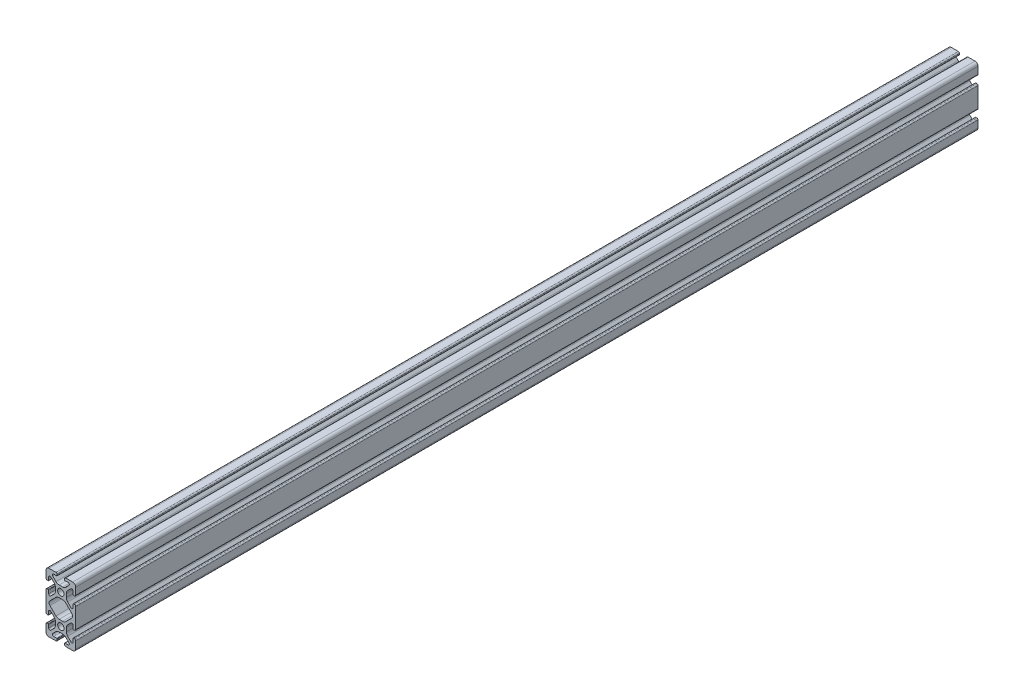
from build123d import *

# Parameters (mm, degrees)
SKETCH3_R           = 2.15
BOSS_EXTRUDE1_DEPTH = 304.8
CIRPATTERN1_COUNT   = 2
SKETCH4_R           = 2.15
CUT_EXTRUDE1_DEPTH  = 2.09


with BuildPart() as part:
    # Sketch3 → Boss-Extrude1 (new, symmetric)
    with BuildSketch(Plane.XY):
        with BuildLine():
            Line((-8.5, 7.5), (-9.2, 7.5))
            ThreePointArc((-9.2, 7.5), (-9.765685425, 7.265685425), (-10, 6.7))
            Line((-10, 6.7), (-10, 0))
            Line((-10, 0), (-7.916458339, 0))
            ThreePointArc((-7.916458339, 0), (-7.764217404, 0.765366865), (-7.330671901, 1.414213562))
            Line((-7.330671901, 1.414213562), (-3.32356512, 5.421320344))
            ThreePointArc((-3.32356512, 5.421320344), (-2.350295073, 6.071638598), (-1.202244776, 6.3))
            Line((-1.202244776, 6.3), (1.202244776, 6.3))
            ThreePointArc((1.202244776, 6.3), (2.350295073, 6.071638598), (3.32356512, 5.421320344))
            Line((3.32356512, 5.421320344), (7.330671901, 1.414213562))
            ThreePointArc((7.330671901, 1.414213562), (7.764217404, 0.765366865), (7.916458339, 0))
            Line((7.916458339, 0), (10, 0))
            Line((10, 0), (10, 6.7))
            ThreePointArc((10, 6.7), (9.765685425, 7.265685425), (9.2, 7.5))
            Line((9.2, 7.5), (8.5, 7.5))
            ThreePointArc((8.5, 7.5), (8.287867966, 7.412132034), (8.2, 7.2))
            Line((8.2, 7.2), (8.2, 5.094911614))
            ThreePointArc((8.2, 5.094911614), (7.678422063, 4.314315067), (6.757645654, 4.497468882))
            Line((6.757645654, 4.497468882), (4.578679656, 6.67643488))
            ThreePointArc((4.578679656, 6.67643488), (3.928361402, 7.649704927), (3.7, 8.797755224))
            Line((3.7, 8.797755224), (3.7, 11.202244776))
            ThreePointArc((3.7, 11.202244776), (3.928361402, 12.350295073), (4.578679656, 13.32356512))
            Line((4.578679656, 13.32356512), (6.757645654, 15.502531118))
            ThreePointArc((6.757645654, 15.502531118), (7.678422063, 15.685684933), (8.2, 14.905088386))
            Line((8.2, 14.905088386), (8.2, 12.8))
            ThreePointArc((8.2, 12.8), (8.287867966, 12.587867966), (8.5, 12.5))
            Line((8.5, 12.5), (9.2, 12.5))
            ThreePointArc((9.2, 12.5), (9.765685425, 12.734314575), (10, 13.3))
            Line((10, 13.3), (10, 18))
            ThreePointArc((10, 18), (9.414213562, 19.414213562), (8, 20))
            Line((8, 20), (3.3, 20))
            ThreePointArc((3.3, 20), (2.734314575, 19.765685425), (2.5, 19.2))
            Line((2.5, 19.2), (2.5, 18.5))
            ThreePointArc((2.5, 18.5), (2.587867966, 18.287867966), (2.8, 18.2))
            Line((2.8, 18.2), (4.905088386, 18.2))
            ThreePointArc((4.905088386, 18.2), (5.685684933, 17.678422063), (5.502531118, 16.757645654))
            Line((5.502531118, 16.757645654), (3.32356512, 14.578679656))
            ThreePointArc((3.32356512, 14.578679656), (2.350295073, 13.928361402), (1.202244776, 13.7))
            Line((1.202244776, 13.7), (-1.202244776, 13.7))
            ThreePointArc((-1.202244776, 13.7), (-2.350295073, 13.928361402), (-3.32356512, 14.578679656))
            Line((-3.32356512, 14.578679656), (-5.502531118, 16.757645654))
            ThreePointArc((-5.502531118, 16.757645654), (-5.685684933, 17.678422063), (-4.905088386, 18.2))
            Line((-4.905088386, 18.2), (-2.8, 18.2))
            ThreePointArc((-2.8, 18.2), (-2.587867966, 18.287867966), (-2.5, 18.5))
            Line((-2.5, 18.5), (-2.5, 19.2))
            ThreePointArc((-2.5, 19.2), (-2.734314575, 19.765685425), (-3.3, 20))
            Line((-3.3, 20), (-8, 20))
            ThreePointArc((-8, 20), (-9.414213562, 19.414213562), (-10, 18))
            Line((-10, 18), (-10, 13.3))
            ThreePointArc((-10, 13.3), (-9.765685425, 12.734314575), (-9.2, 12.5))
            Line((-9.2, 12.5), (-8.5, 12.5))
            ThreePointArc((-8.5, 12.5), (-8.287867966, 12.587867966), (-8.2, 12.8))
            Line((-8.2, 12.8), (-8.2, 14.905088386))
            ThreePointArc((-8.2, 14.905088386), (-7.678422063, 15.685684933), (-6.757645654, 15.502531118))
            Line((-6.757645654, 15.502531118), (-4.578679656, 13.32356512))
            ThreePointArc((-4.578679656, 13.32356512), (-3.928361402, 12.350295073), (-3.7, 11.202244776))
            Line((-3.7, 11.202244776), (-3.7, 8.797755224))
            ThreePointArc((-3.7, 8.797755224), (-3.928361402, 7.649704927), (-4.578679656, 6.67643488))
            Line((-4.578679656, 6.67643488), (-6.757645654, 4.497468882))
            ThreePointArc((-6.757645654, 4.497468882), (-7.678422063, 4.314315067), (-8.2, 5.094911614))
            Line((-8.2, 5.094911614), (-8.2, 7.2))
            ThreePointArc((-8.2, 7.2), (-8.287867966, 7.412132034), (-8.5, 7.5))
        make_face()
        with Locations(Location((0, 10, 0), (0, 0, 180))):
            Circle(SKETCH3_R, mode=Mode.SUBTRACT)
    boss_extrude1 = extrude(amount=BOSS_EXTRUDE1_DEPTH, both=True)

    # CirPattern1: Boss-Extrude1 ×2 about axis
    cirpattern1_axis = Axis((0, 0, 0), (0, 0, 1))
    for i in range(1, CIRPATTERN1_COUNT):
        add(boss_extrude1.rotate(cirpattern1_axis, i * 360 / CIRPATTERN1_COUNT))

    # Sketch4 → Cut-Extrude1 (cut)
    with BuildSketch(Plane.XY.offset(304.8)):
        with BuildLine():
            Line((-2.5, 18.5), (-2.5, 19.2))
            ThreePointArc((-2.5, 19.2), (-2.734314575, 19.765685425), (-3.3, 20))
            Line((-3.3, 20), (-8, 20))
            ThreePointArc((-8, 20), (-9.414213562, 19.414213562), (-10, 18))
            Line((-10, 18), (-10, 13.3))
            ThreePointArc((-10, 13.3), (-9.765685425, 12.734314575), (-9.2, 12.5))
            Line((-9.2, 12.5), (-8.5, 12.5))
            ThreePointArc((-8.5, 12.5), (-8.287867966, 12.587867966), (-8.2, 12.8))
            Line((-8.2, 12.8), (-8.2, 14.905088386))
            ThreePointArc((-8.2, 14.905088386), (-7.678422063, 15.685684933), (-6.757645654, 15.502531118))
            Line((-6.757645654, 15.502531118), (-4.578679656, 13.32356512))
            ThreePointArc((-4.578679656, 13.32356512), (-3.928361402, 12.350295073), (-3.7, 11.202244776))
            Line((-3.7, 11.202244776), (-3.7, 8.797755224))
            ThreePointArc((-3.7, 8.797755224), (-3.928361402, 7.649704927), (-4.578679656, 6.67643488))
            Line((-4.578679656, 6.67643488), (-6.757645654, 4.497468882))
            ThreePointArc((-6.757645654, 4.497468882), (-7.678422063, 4.314315067), (-8.2, 5.094911614))
            Line((-8.2, 5.094911614), (-8.2, 7.2))
            ThreePointArc((-8.2, 7.2), (-8.287867966, 7.412132034), (-8.5, 7.5))
            Line((-8.5, 7.5), (-9.2, 7.5))
            ThreePointArc((-9.2, 7.5), (-9.765685425, 7.265685425), (-10, 6.7))
            Line((-10, 6.7), (-10, -6.7))
            ThreePointArc((-10, -6.7), (-9.765685425, -7.265685425), (-9.2, -7.5))
            Line((-9.2, -7.5), (-8.5, -7.5))
            ThreePointArc((-8.5, -7.5), (-8.287867966, -7.412132034), (-8.2, -7.2))
            Line((-8.2, -7.2), (-8.2, -5.094911614))
            ThreePointArc((-8.2, -5.094911614), (-7.678422063, -4.314315067), (-6.757645654, -4.497468882))
            Line((-6.757645654, -4.497468882), (-4.578679656, -6.67643488))
            ThreePointArc((-4.578679656, -6.67643488), (-3.928361402, -7.649704927), (-3.7, -8.797755224))
            Line((-3.7, -8.797755224), (-3.7, -11.202244776))
            ThreePointArc((-3.7, -11.202244776), (-3.928361402, -12.350295073), (-4.578679656, -13.32356512))
            Line((-4.578679656, -13.32356512), (-6.757645654, -15.502531118))
            ThreePointArc((-6.757645654, -15.502531118), (-7.678422063, -15.685684933), (-8.2, -14.905088386))
            Line((-8.2, -14.905088386), (-8.2, -12.8))
            ThreePointArc((-8.2, -12.8), (-8.287867966, -12.587867966), (-8.5, -12.5))
            Line((-8.5, -12.5), (-9.2, -12.5))
            ThreePointArc((-9.2, -12.5), (-9.765685425, -12.734314575), (-10, -13.3))
            Line((-10, -13.3), (-10, -18))
            ThreePointArc((-10, -18), (-9.414213562, -19.414213562), (-8, -20))
            Line((-8, -20), (-3.3, -20))
            ThreePointArc((-3.3, -20), (-2.734314575, -19.765685425), (-2.5, -19.2))
            Line((-2.5, -19.2), (-2.5, -18.5))
            ThreePointArc((-2.5, -18.5), (-2.587867966, -18.287867966), (-2.8, -18.2))
            Line((-2.8, -18.2), (-4.905088386, -18.2))
            ThreePointArc((-4.905088386, -18.2), (-5.685684933, -17.678422063), (-5.502531118, -16.757645654))
            Line((-5.502531118, -16.757645654), (-3.32356512, -14.578679656))
            ThreePointArc((-3.32356512, -14.578679656), (-2.350295073, -13.928361402), (-1.202244776, -13.7))
            Line((-1.202244776, -13.7), (1.202244776, -13.7))
            ThreePointArc((1.202244776, -13.7), (2.350295073, -13.928361402), (3.32356512, -14.578679656))
            Line((3.32356512, -14.578679656), (5.502531118, -16.757645654))
            ThreePointArc((5.502531118, -16.757645654), (5.685684933, -17.678422063), (4.905088386, -18.2))
            Line((4.905088386, -18.2), (2.8, -18.2))
            ThreePointArc((2.8, -18.2), (2.587867966, -18.287867966), (2.5, -18.5))
            Line((2.5, -18.5), (2.5, -19.2))
            ThreePointArc((2.5, -19.2), (2.734314575, -19.765685425), (3.3, -20))
            Line((3.3, -20), (8, -20))
            ThreePointArc((8, -20), (9.414213562, -19.414213562), (10, -18))
            Line((10, -18), (10, -13.3))
            ThreePointArc((10, -13.3), (9.765685425, -12.734314575), (9.2, -12.5))
            Line((9.2, -12.5), (8.5, -12.5))
            ThreePointArc((8.5, -12.5), (8.287867966, -12.587867966), (8.2, -12.8))
            Line((8.2, -12.8), (8.2, -14.905088386))
            ThreePointArc((8.2, -14.905088386), (7.678422063, -15.685684933), (6.757645654, -15.502531118))
            Line((6.757645654, -15.502531118), (4.578679656, -13.32356512))
            ThreePointArc((4.578679656, -13.32356512), (3.928361402, -12.350295073), (3.7, -11.202244776))
            Line((3.7, -11.202244776), (3.7, -8.797755224))
            ThreePointArc((3.7, -8.797755224), (3.928361402, -7.649704927), (4.578679656, -6.67643488))
            Line((4.578679656, -6.67643488), (6.757645654, -4.497468882))
            ThreePointArc((6.757645654, -4.497468882), (7.678422063, -4.314315067), (8.2, -5.094911614))
            Line((8.2, -5.094911614), (8.2, -7.2))
            ThreePointArc((8.2, -7.2), (8.287867966, -7.412132034), (8.5, -7.5))
            Line((8.5, -7.5), (9.2, -7.5))
            ThreePointArc((9.2, -7.5), (9.765685425, -7.265685425), (10, -6.7))
            Line((10, -6.7), (10, 6.7))
            ThreePointArc((10, 6.7), (9.765685425, 7.265685425), (9.2, 7.5))
            Line((9.2, 7.5), (8.5, 7.5))
            ThreePointArc((8.5, 7.5), (8.287867966, 7.412132034), (8.2, 7.2))
            Line((8.2, 7.2), (8.2, 5.094911614))
            ThreePointArc((8.2, 5.094911614), (7.678422063, 4.314315067), (6.757645654, 4.497468882))
            Line((6.757645654, 4.497468882), (4.578679656, 6.67643488))
            ThreePointArc((4.578679656, 6.67643488), (3.928361402, 7.649704927), (3.7, 8.797755224))
            Line((3.7, 8.797755224), (3.7, 11.202244776))
            ThreePointArc((3.7, 11.202244776), (3.928361402, 12.350295073), (4.578679656, 13.32356512))
            Line((4.578679656, 13.32356512), (6.757645654, 15.502531118))
            ThreePointArc((6.757645654, 15.502531118), (7.678422063, 15.685684933), (8.2, 14.905088386))
            Line((8.2, 14.905088386), (8.2, 12.8))
            ThreePointArc((8.2, 12.8), (8.287867966, 12.587867966), (8.5, 12.5))
            Line((8.5, 12.5), (9.2, 12.5))
            ThreePointArc((9.2, 12.5), (9.765685425, 12.734314575), (10, 13.3))
            Line((10, 13.3), (10, 18))
            ThreePointArc((10, 18), (9.414213562, 19.414213562), (8, 20))
            Line((8, 20), (3.3, 20))
            ThreePointArc((3.3, 20), (2.734314575, 19.765685425), (2.5, 19.2))
            Line((2.5, 19.2), (2.5, 18.5))
            ThreePointArc((2.5, 18.5), (2.587867966, 18.287867966), (2.8, 18.2))
            Line((2.8, 18.2), (4.905088386, 18.2))
            ThreePointArc((4.905088386, 18.2), (5.685684933, 17.678422063), (5.502531118, 16.757645654))
            Line((5.502531118, 16.757645654), (3.32356512, 14.578679656))
            ThreePointArc((3.32356512, 14.578679656), (2.350295073, 13.928361402), (1.202244776, 13.7))
            Line((1.202244776, 13.7), (-1.202244776, 13.7))
            ThreePointArc((-1.202244776, 13.7), (-2.350295073, 13.928361402), (-3.32356512, 14.578679656))
            Line((-3.32356512, 14.578679656), (-5.502531118, 16.757645654))
            ThreePointArc((-5.502531118, 16.757645654), (-5.685684933, 17.678422063), (-4.905088386, 18.2))
            Line((-4.905088386, 18.2), (-2.8, 18.2))
            ThreePointArc((-2.8, 18.2), (-2.587867966, 18.287867966), (-2.5, 18.5))
        make_face()
        with Locations(Location((0, 10, 0), (0, 0, 180))):
            Circle(SKETCH4_R, mode=Mode.SUBTRACT)
        with Locations(Location((0, -10, 0), (0, 0, 90))):
            Circle(SKETCH4_R, mode=Mode.SUBTRACT)
        with BuildLine():
            Line((7.330671901, -1.414213562), (3.32356512, -5.421320344))
            ThreePointArc((3.32356512, -5.421320344), (2.350295073, -6.071638598), (1.202244776, -6.3))
            Line((1.202244776, -6.3), (-1.202244776, -6.3))
            ThreePointArc((-1.202244776, -6.3), (-2.350295073, -6.071638598), (-3.32356512, -5.421320344))
            Line((-3.32356512, -5.421320344), (-7.330671901, -1.414213562))
            ThreePointArc((-7.330671901, -1.414213562), (-7.916458339, 0), (-7.330671901, 1.414213562))
            Line((-7.330671901, 1.414213562), (-3.32356512, 5.421320344))
            ThreePointArc((-3.32356512, 5.421320344), (-2.350295073, 6.071638598), (-1.202244776, 6.3))
            Line((-1.202244776, 6.3), (1.202244776, 6.3))
            ThreePointArc((1.202244776, 6.3), (2.350295073, 6.071638598), (3.32356512, 5.421320344))
            Line((3.32356512, 5.421320344), (7.330671901, 1.414213562))
            ThreePointArc((7.330671901, 1.414213562), (7.916458339, 0), (7.330671901, -1.414213562))
        make_face(mode=Mode.SUBTRACT)
    extrude(amount=-CUT_EXTRUDE1_DEPTH, mode=Mode.SUBTRACT)


solid = part.part
